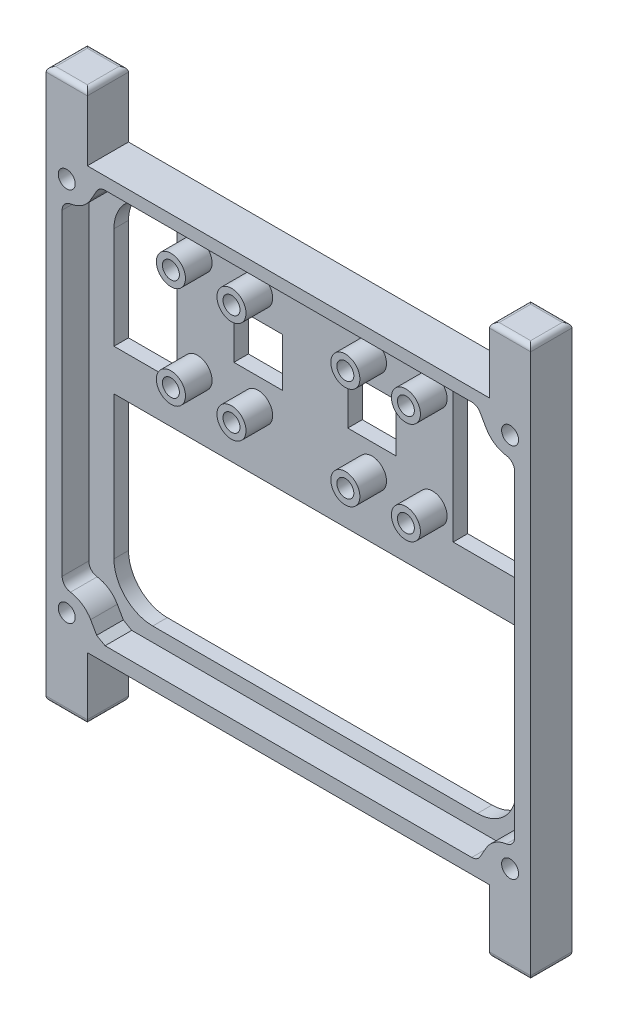
from build123d import *

# Parameters (mm, degrees)
SKETCH1_W           = 100
SKETCH1_H           = 113.5
BOSS_EXTRUDE1_DEPTH = 8.5
CUT_EXTRUDE1_REACH  = 78.111
SKETCH2_W           = 83
SKETCH2_H           = 13.5
SKETCH2_H_2         = 13
SKETCH2_W_2         = 10
SKETCH2_H_3         = 10
SKETCH2_R           = 1.75
CUT_EXTRUDE2_REACH  = 78.111
SKETCH6_W           = 10
SKETCH6_H           = 10
CUT_EXTRUDE4_DEPTH  = 5.5
SKETCH7_R           = 3
SKETCH7_R_2         = 1.75
BOSS_EXTRUDE3_DEPTH = 5.5
FILLET1_R           = 1


with BuildPart() as part:
    # Sketch1 → Boss-Extrude1 (new body)
    with BuildSketch(Plane.XY):
        Rectangle(SKETCH1_W, SKETCH1_H)
    extrude(amount=BOSS_EXTRUDE1_DEPTH)

    # Sketch2 → Cut-Extrude1 (cut, up to next)
    with BuildSketch(Plane.XY.offset(8.5), mode=Mode.PRIVATE) as cut_extrude1_sk1:
        with Locations((0, 50)):
            Rectangle(SKETCH2_W, SKETCH2_H)
    cut_extrude1_tool1 = extrude(cut_extrude1_sk1.sketch, amount=-CUT_EXTRUDE1_REACH, mode=Mode.PRIVATE) & part.part
    # Sketch2 → Cut-Extrude1 (cut, up to next)
    with BuildSketch(Plane.XY.offset(8.5), mode=Mode.PRIVATE) as cut_extrude1_sk2:
        with BuildLine():
            ThreePointArc((-41.5, -29.75), (-39.156854249, -35.406854249), (-33.5, -37.75))
            Line((-33.5, -37.75), (33.5, -37.75))
            ThreePointArc((33.5, -37.75), (39.156854249, -35.406854249), (41.5, -29.75))
            Line((41.5, -29.75), (41.5, -0.25))
            Line((41.5, -0.25), (-41.5, -0.25))
            Line((-41.5, -0.25), (-41.5, -29.75))
        make_face()
    cut_extrude1_tool2 = extrude(cut_extrude1_sk2.sketch, amount=-CUT_EXTRUDE1_REACH, mode=Mode.PRIVATE) & part.part
    # Sketch2 → Cut-Extrude1 (cut, up to next)
    with BuildSketch(Plane.XY.offset(8.5), mode=Mode.PRIVATE) as cut_extrude1_sk3:
        with Locations((0, -50.25)):
            Rectangle(SKETCH2_W, SKETCH2_H_2)
    cut_extrude1_tool3 = extrude(cut_extrude1_sk3.sketch, amount=-CUT_EXTRUDE1_REACH, mode=Mode.PRIVATE) & part.part
    # Sketch2 → Cut-Extrude1 (cut, up to next)
    with BuildSketch(Plane.XY.offset(8.5), mode=Mode.PRIVATE) as cut_extrude1_sk4:
        with Locations((-11.75, 22.75)):
            Rectangle(SKETCH2_W_2, SKETCH2_H_3)
    cut_extrude1_tool4 = extrude(cut_extrude1_sk4.sketch, amount=-CUT_EXTRUDE1_REACH, mode=Mode.PRIVATE) & part.part
    # Sketch2 → Cut-Extrude1 (cut, up to next)
    with BuildSketch(Plane.XY.offset(8.5), mode=Mode.PRIVATE) as cut_extrude1_sk5:
        with Locations((45.75, 38.75)):
            Circle(SKETCH2_R)
    cut_extrude1_tool5 = extrude(cut_extrude1_sk5.sketch, amount=-CUT_EXTRUDE1_REACH, mode=Mode.PRIVATE) & part.part
    # Sketch2 → Cut-Extrude1 (cut, up to next)
    with BuildSketch(Plane.XY.offset(8.5), mode=Mode.PRIVATE) as cut_extrude1_sk6:
        with Locations((45.75, -38.75)):
            Circle(SKETCH2_R)
    cut_extrude1_tool6 = extrude(cut_extrude1_sk6.sketch, amount=-CUT_EXTRUDE1_REACH, mode=Mode.PRIVATE) & part.part
    # Sketch2 → Cut-Extrude1 (cut, up to next)
    with BuildSketch(Plane.XY.offset(8.5), mode=Mode.PRIVATE) as cut_extrude1_sk7:
        with Locations((-45.75, 38.75)):
            Circle(SKETCH2_R)
    cut_extrude1_tool7 = extrude(cut_extrude1_sk7.sketch, amount=-CUT_EXTRUDE1_REACH, mode=Mode.PRIVATE) & part.part
    # Sketch2 → Cut-Extrude1 (cut, up to next)
    with BuildSketch(Plane.XY.offset(8.5), mode=Mode.PRIVATE) as cut_extrude1_sk8:
        with Locations((-45.75, -38.75)):
            Circle(SKETCH2_R)
    cut_extrude1_tool8 = extrude(cut_extrude1_sk8.sketch, amount=-CUT_EXTRUDE1_REACH, mode=Mode.PRIVATE) & part.part
    add(cut_extrude1_tool1.solids().sort_by_distance((0, 50, 8.5))[0], mode=Mode.SUBTRACT)
    add(cut_extrude1_tool2.solids().sort_by_distance((0, -18.848961, 8.5))[0], mode=Mode.SUBTRACT)
    add(cut_extrude1_tool3.solids().sort_by_distance((0, -50.25, 8.5))[0], mode=Mode.SUBTRACT)
    add(cut_extrude1_tool4.solids().sort_by_distance((-11.75, 22.75, 8.5))[0], mode=Mode.SUBTRACT)
    add(cut_extrude1_tool5.solids().sort_by_distance((45.75, 38.75, 8.5))[0], mode=Mode.SUBTRACT)
    add(cut_extrude1_tool6.solids().sort_by_distance((45.75, -38.75, 8.5))[0], mode=Mode.SUBTRACT)
    add(cut_extrude1_tool7.solids().sort_by_distance((-45.75, 38.75, 8.5))[0], mode=Mode.SUBTRACT)
    add(cut_extrude1_tool8.solids().sort_by_distance((-45.75, -38.75, 8.5))[0], mode=Mode.SUBTRACT)

    # Sketch6 → Cut-Extrude2 (cut, up to next)
    with BuildSketch(Plane.XY.offset(8.5), mode=Mode.PRIVATE) as cut_extrude2_sk1:
        with BuildLine():
            Line((41.5, 8.25), (41.5, 29.25))
            ThreePointArc((41.5, 29.25), (39.156854249, 34.906854249), (33.5, 37.25))
            Line((33.5, 37.25), (28.5, 37.25))
            Line((28.5, 37.25), (28.5, 8.25))
            Line((28.5, 8.25), (33.5, 8.25))
            Line((33.5, 8.25), (41.5, 8.25))
        make_face()
    cut_extrude2_tool1 = extrude(cut_extrude2_sk1.sketch, amount=-CUT_EXTRUDE2_REACH, mode=Mode.PRIVATE) & part.part
    # Sketch6 → Cut-Extrude2 (cut, up to next)
    with BuildSketch(Plane.XY.offset(8.5), mode=Mode.PRIVATE) as cut_extrude2_sk2:
        with Locations((11.75, 22.75)):
            Rectangle(SKETCH6_W, SKETCH6_H)
    cut_extrude2_tool2 = extrude(cut_extrude2_sk2.sketch, amount=-CUT_EXTRUDE2_REACH, mode=Mode.PRIVATE) & part.part
    # Sketch6 → Cut-Extrude2 (cut, up to next)
    with BuildSketch(Plane.XY.offset(8.5), mode=Mode.PRIVATE) as cut_extrude2_sk3:
        with BuildLine():
            Line((-41.5, 8.25), (-41.5, 29.25))
            ThreePointArc((-41.5, 29.25), (-39.156854249, 34.906854249), (-33.5, 37.25))
            Line((-33.5, 37.25), (-28.5, 37.25))
            Line((-28.5, 37.25), (-28.5, 8.25))
            Line((-28.5, 8.25), (-33.5, 8.25))
            Line((-33.5, 8.25), (-41.5, 8.25))
        make_face()
    cut_extrude2_tool3 = extrude(cut_extrude2_sk3.sketch, amount=-CUT_EXTRUDE2_REACH, mode=Mode.PRIVATE) & part.part
    add(cut_extrude2_tool1.solids().sort_by_distance((34.821806, 22.269339, 8.5))[0], mode=Mode.SUBTRACT)
    add(cut_extrude2_tool2.solids().sort_by_distance((11.75, 22.75, 8.5))[0], mode=Mode.SUBTRACT)
    add(cut_extrude2_tool3.solids().sort_by_distance((-34.821806, 22.269339, 8.5))[0], mode=Mode.SUBTRACT)

    # Sketch8 → Cut-Extrude4 (cut)
    with BuildSketch(Plane.XY.offset(8.5)):
        with BuildLine():
            Line((-37.835, -40.7), (37.835, -40.7))
            ThreePointArc((37.835, -40.7), (38.836346779, -40.434383498), (39.567050808, -39.7))
            Line((39.567050808, -39.7), (40.811116722, -37.52))
            ThreePointArc((40.811116722, -37.52), (42.571113581, -35.629410248), (44.981116722, -34.7))
            ThreePointArc((44.981116722, -34.7), (46.210984272, -34.031299083), (46.701116722, -32.72))
            Line((46.701116722, -32.72), (46.701116722, 32.72))
            ThreePointArc((46.701116722, 32.72), (46.210984272, 34.031299083), (44.981116722, 34.7))
            ThreePointArc((44.981116722, 34.7), (42.571113581, 35.629410248), (40.811116722, 37.52))
            Line((40.811116722, 37.52), (39.567050808, 39.7))
            ThreePointArc((39.567050808, 39.7), (38.836346779, 40.434383498), (37.835, 40.7))
            Line((37.835, 40.7), (-37.835, 40.7))
            ThreePointArc((-37.835, 40.7), (-38.836346779, 40.434383498), (-39.567050808, 39.7))
            Line((-39.567050808, 39.7), (-40.811116722, 37.52))
            ThreePointArc((-40.811116722, 37.52), (-42.571113581, 35.629410248), (-44.981116722, 34.7))
            ThreePointArc((-44.981116722, 34.7), (-46.210984272, 34.031299083), (-46.701116722, 32.72))
            Line((-46.701116722, 32.72), (-46.701116722, -32.72))
            ThreePointArc((-46.701116722, -32.72), (-46.210984272, -34.031299083), (-44.981116722, -34.7))
            ThreePointArc((-44.981116722, -34.7), (-42.571113581, -35.629410248), (-40.811116722, -37.52))
            Line((-40.811116722, -37.52), (-39.567050808, -39.7))
            Line((-39.567050808, -39.7), (-37.835, -40.7))
        make_face()
    extrude(amount=-CUT_EXTRUDE4_DEPTH, mode=Mode.SUBTRACT)

    # Sketch7 → Boss-Extrude3 (add)
    # profile 1 of 8: a face of its own
    with BuildSketch(Plane.XY.offset(8.5)):
        with Locations((-24.25, 33.25)):
            Circle(SKETCH7_R)
        with Locations((-24.25, 33.25)):
            Circle(SKETCH7_R_2, mode=Mode.SUBTRACT)
    # profile 2 of 8: a face of its own
    with BuildSketch(Plane.XY.offset(8.5)):
        with Locations((-24.25, 12.25)):
            Circle(SKETCH7_R)
        with Locations((-24.25, 12.25)):
            Circle(SKETCH7_R_2, mode=Mode.SUBTRACT)
    # profile 3 of 8: a face of its own
    with BuildSketch(Plane.XY.offset(8.5)):
        with Locations((-11.75, 12.25)):
            Circle(SKETCH7_R)
        with Locations((-11.75, 12.25)):
            Circle(SKETCH7_R_2, mode=Mode.SUBTRACT)
    # profile 4 of 8: a face of its own
    with BuildSketch(Plane.XY.offset(8.5)):
        with Locations((11.75, 33.25)):
            Circle(SKETCH7_R)
        with Locations((11.75, 33.25)):
            Circle(SKETCH7_R_2, mode=Mode.SUBTRACT)
    # profile 5 of 8: a face of its own
    with BuildSketch(Plane.XY.offset(8.5)):
        with Locations((24.25, 33.25)):
            Circle(SKETCH7_R)
        with Locations((24.25, 33.25)):
            Circle(SKETCH7_R_2, mode=Mode.SUBTRACT)
    # profile 6 of 8: a face of its own
    with BuildSketch(Plane.XY.offset(8.5)):
        with Locations((11.75, 12.25)):
            Circle(SKETCH7_R)
        with Locations((11.75, 12.25)):
            Circle(SKETCH7_R_2, mode=Mode.SUBTRACT)
    # profile 7 of 8: a face of its own
    with BuildSketch(Plane.XY.offset(8.5)):
        with Locations((24.25, 12.25)):
            Circle(SKETCH7_R)
        with Locations((24.25, 12.25)):
            Circle(SKETCH7_R_2, mode=Mode.SUBTRACT)
    # profile 8 of 8: a face of its own
    with BuildSketch(Plane.XY.offset(8.5)):
        with Locations((-11.75, 33.25)):
            Circle(SKETCH7_R)
        with Locations((-11.75, 33.25)):
            Circle(SKETCH7_R_2, mode=Mode.SUBTRACT)
    extrude(amount=-BOSS_EXTRUDE3_DEPTH)

    # Fillet1
    fillet1_edges = [part.edges().sort_by_distance(p)[0] for p in [
        (45.75, -56.75, 0),
        (-45.75, 56.75, 0),
        (-45.75, -56.75, 8.5),
        (-45.75, 56.75, 8.5),
        (45.75, -56.75, 8.5),
        (-41.5, 56.75, 4.25),
        (41.5, 56.75, 4.25),
        (41.5, -56.75, 4.25),
        (-41.5, -56.75, 4.25),
        (-45.75, -56.75, 0),
        (45.75, 56.75, 0),
        (50, -56.75, 4.25),
        (-50, -56.75, 4.25),
        (-50, 56.75, 4.25),
        (50, 56.75, 4.25),
        (45.75, 56.75, 8.5),
    ]]
    fillet(fillet1_edges, radius=FILLET1_R)


solid = part.part
